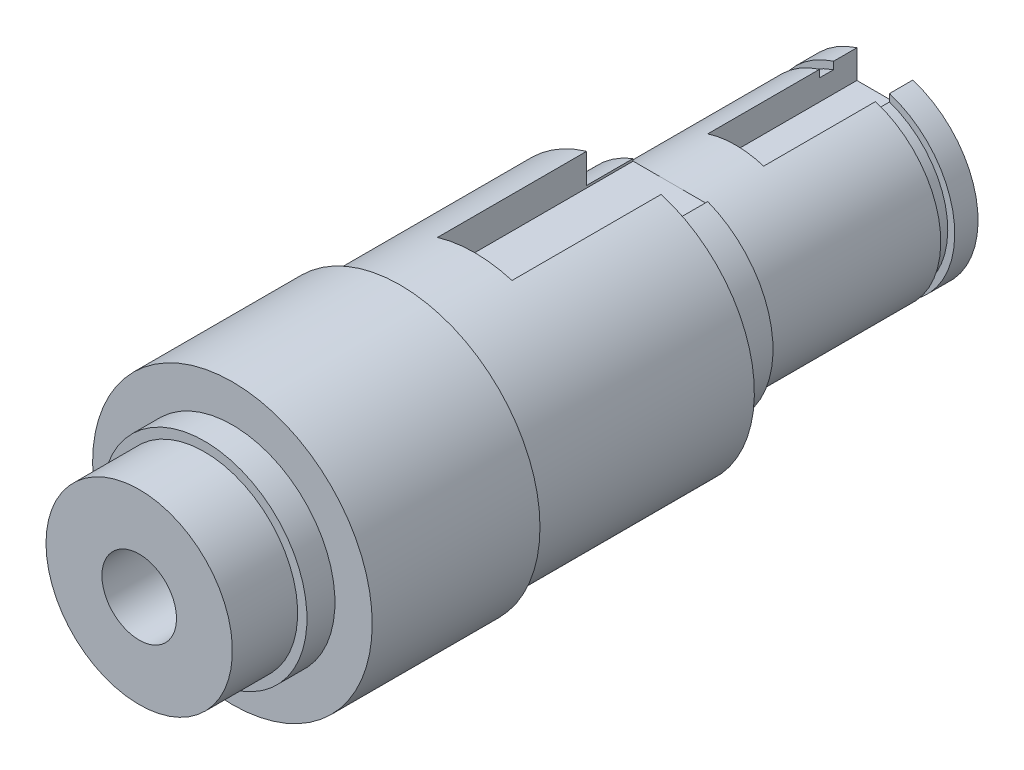
from build123d import *

# Parameters (mm, degrees)
CUT_EXTRUDE3_DEPTH      = 10
CUT_EXTRUDE3_DEPTH_BACK = 16
CUT_EXTRUDE4_DEPTH      = 16
SKETCH7_W               = 0.75
SKETCH7_H               = 1.5


with BuildPart() as part:
    # Sketch1 → Revolve1 (revolve)
    with BuildSketch(Plane(origin=(0, 0, 0), x_dir=(1, 0, 0), z_dir=(0, 1, 0)), mode=Mode.PRIVATE) as revolve1_sk:
        Polygon((4, 0), (10, 0), (10, 7), (11, 7), (11, 10), (15, 10), (15, 28), (14, 28), (14, 52), (11, 52), (11, 57), (10, 57), (10, 80), (4, 80), align=None)
    revolve(revolve1_sk.sketch.rotate(Axis((0, 0, -122.779357785), (0, 0, 1)), 180), axis=Axis((0, 0, -122.779357785), (0, 0, 1)))

    # Sketch5 → Cut-Extrude3 (cut, two sides: drawn at the far end of the back side and taken through both)
    with BuildSketch(Plane(origin=(0, 0, -52), x_dir=(-1, 0, 0), z_dir=(0, 0, -1)).offset(-CUT_EXTRUDE3_DEPTH_BACK)):
        Polygon((-4, 91.782839275), (-4, 13.416407865), (-4, 10), (4, 10), (4, 13.416407865), (4, 91.782839275), (4, 248.515702096), (-4, 248.515702096), align=None)
    extrude(amount=CUT_EXTRUDE3_DEPTH + CUT_EXTRUDE3_DEPTH_BACK, mode=Mode.SUBTRACT)

    # Sketch6 → Cut-Extrude4 (cut)
    with BuildSketch(Plane(origin=(0, 0, -80), x_dir=(-1, 0, 0), z_dir=(0, 0, -1))):
        Polygon((-3, 80.405860958), (-3, 9.539392014), (-3, 6.5), (3, 6.5), (3, 9.539392014), (3, 80.405860958), (3, 222.138798846), (-3, 222.138798846), align=None)
    extrude(amount=-CUT_EXTRUDE4_DEPTH, mode=Mode.SUBTRACT)

    # Sketch7 → Cut-Revolve1 (revolve, cut)
    with BuildSketch(Plane(origin=(0, 0, 0), x_dir=(1, 0, 0), z_dir=(0, 1, 0)), mode=Mode.PRIVATE) as cut_revolve1_sk:
        with Locations((9.625, 76.75)):
            Rectangle(SKETCH7_W, SKETCH7_H)
    revolve(cut_revolve1_sk.sketch.rotate(Axis((0, 0, 11.784239999), (0, 0, -1)), 252.542396876), axis=Axis((0, 0, 11.784239999), (0, 0, -1)), mode=Mode.SUBTRACT)


solid = part.part
